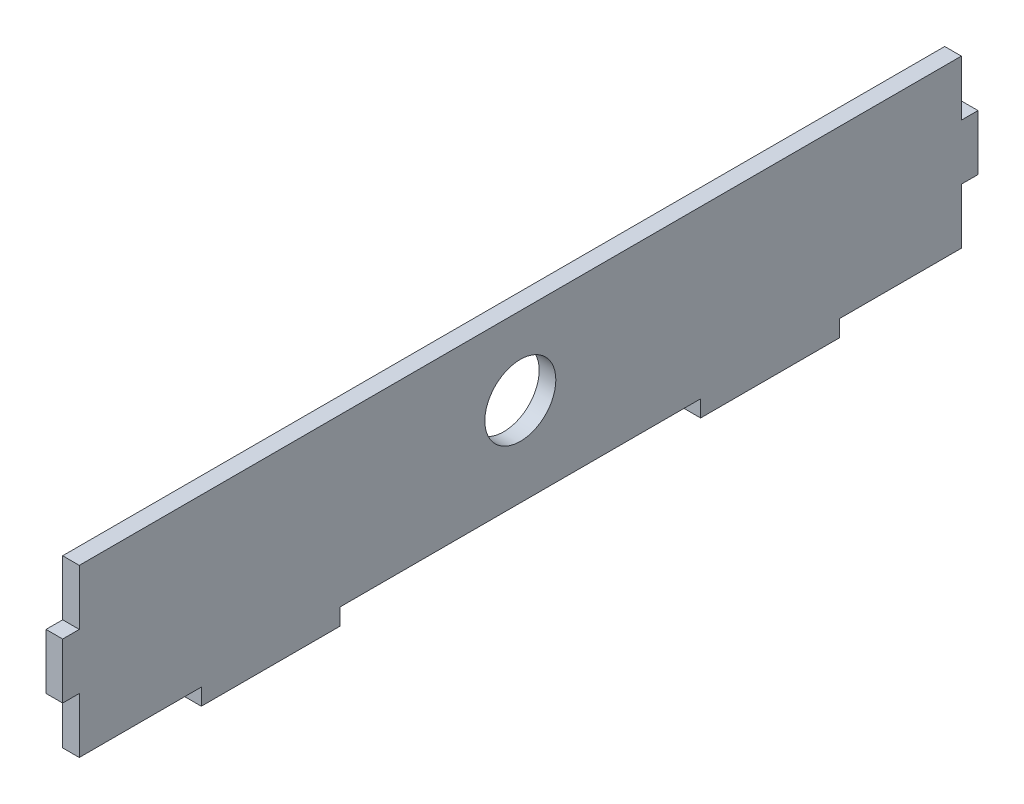
from build123d import *

# Parameters (mm, degrees)
SKETCH2_R           = 6.4
BOSS_EXTRUDE3_DEPTH = 3


with BuildPart() as part:
    # Sketch2 → Boss-Extrude3 (new body)
    with BuildSketch(Plane(origin=(0, 0, 0), x_dir=(0, 0, -1), z_dir=(1, 0, 0))):
        Polygon((-57.5, -15), (-79.5, -15), (-79.5, -5), (-82.5, -5), (-82.5, 5), (-79.5, 5), (-79.5, 15), (79.5, 15), (79.5, 5), (82.5, 5), (82.5, -5), (79.5, -5), (79.5, -15), (57.5, -15), (57.5, -18), (32.5, -18), (32.5, -15), (-32.5, -15), (-32.5, -18), (-57.5, -18), align=None)
        with Locations((0, 1)):
            Circle(SKETCH2_R, mode=Mode.SUBTRACT)
    extrude(amount=BOSS_EXTRUDE3_DEPTH)


solid = part.part
